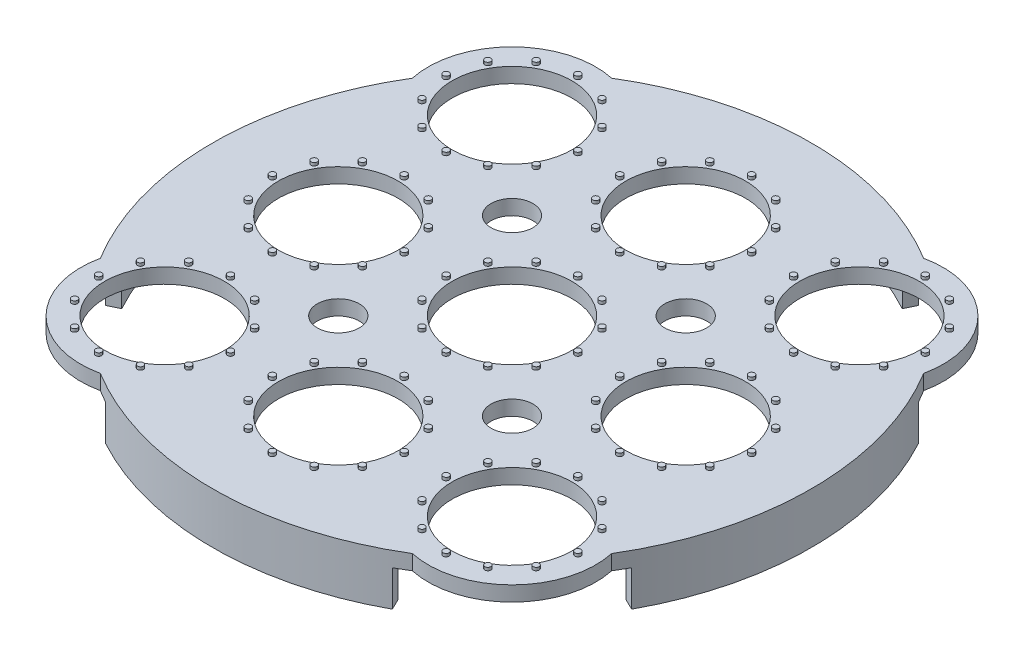
from build123d import *

# Parameters (mm, degrees)
BOSS_EXTRUDE1_DEPTH        = 2.5
SKETCH2_R                  = 10
CUT_EXTRUDE1_DEPTH         = 71.75485849
LPATTERN1_COUNT            = 3
LPATTERN1_PITCH            = 29
LPATTERN1_COUNT_DIR2       = 3
LPATTERN1_PITCH_DIR2       = 29
SKETCH4_R                  = 0.5
BOSS_EXTRUDE2_DEPTH        = 0.5
CIRPATTERN1_COUNT          = 12
LPATTERN2_COUNT            = 3
LPATTERN2_PITCH            = 29
LPATTERN2_COUNT_DIR2       = 3
LPATTERN2_PITCH_DIR2       = 29
LPATTERN2_COPY_1_SKETCH_R  = 0.5
LPATTERN2_COPY_1_DEPTH     = 0.5
LPATTERN2_COPY_2_SKETCH_R  = 0.5
LPATTERN2_COPY_2_DEPTH     = 0.5
LPATTERN2_COPY_3_SKETCH_R  = 0.5
LPATTERN2_COPY_3_DEPTH     = 0.5
LPATTERN2_COPY_4_SKETCH_R  = 0.5
LPATTERN2_COPY_4_DEPTH     = 0.5
LPATTERN2_COPY_5_SKETCH_R  = 0.5
LPATTERN2_COPY_5_DEPTH     = 0.5
LPATTERN2_COPY_6_SKETCH_R  = 0.5
LPATTERN2_COPY_6_DEPTH     = 0.5
LPATTERN2_COPY_7_SKETCH_R  = 0.5
LPATTERN2_COPY_7_DEPTH     = 0.5
LPATTERN2_COPY_8_SKETCH_R  = 0.5
LPATTERN2_COPY_8_DEPTH     = 0.5
LPATTERN2_COPY_9_SKETCH_R  = 0.5
LPATTERN2_COPY_9_DEPTH     = 0.5
LPATTERN2_COPY_10_SKETCH_R = 0.5
LPATTERN2_COPY_10_DEPTH    = 0.5
LPATTERN2_COPY_11_SKETCH_R = 0.5
LPATTERN2_COPY_11_DEPTH    = 0.5
LPATTERN2_COPY_12_SKETCH_R = 0.5
LPATTERN2_COPY_12_DEPTH    = 0.5
LPATTERN2_COPY_13_SKETCH_R = 0.5
LPATTERN2_COPY_13_DEPTH    = 0.5
LPATTERN2_COPY_14_SKETCH_R = 0.5
LPATTERN2_COPY_14_DEPTH    = 0.5
LPATTERN2_COPY_15_SKETCH_R = 0.5
LPATTERN2_COPY_15_DEPTH    = 0.5
LPATTERN2_COPY_16_SKETCH_R = 0.5
LPATTERN2_COPY_16_DEPTH    = 0.5
LPATTERN2_COPY_17_SKETCH_R = 0.5
LPATTERN2_COPY_17_DEPTH    = 0.5
LPATTERN2_COPY_18_SKETCH_R = 0.5
LPATTERN2_COPY_18_DEPTH    = 0.5
LPATTERN2_COPY_19_SKETCH_R = 0.5
LPATTERN2_COPY_19_DEPTH    = 0.5
LPATTERN2_COPY_20_SKETCH_R = 0.5
LPATTERN2_COPY_20_DEPTH    = 0.5
LPATTERN2_COPY_21_SKETCH_R = 0.5
LPATTERN2_COPY_21_DEPTH    = 0.5
LPATTERN2_COPY_22_SKETCH_R = 0.5
LPATTERN2_COPY_22_DEPTH    = 0.5
LPATTERN2_COPY_23_SKETCH_R = 0.5
LPATTERN2_COPY_23_DEPTH    = 0.5
LPATTERN2_COPY_24_SKETCH_R = 0.5
LPATTERN2_COPY_24_DEPTH    = 0.5
LPATTERN2_COPY_25_SKETCH_R = 0.5
LPATTERN2_COPY_25_DEPTH    = 0.5
LPATTERN2_COPY_26_SKETCH_R = 0.5
LPATTERN2_COPY_26_DEPTH    = 0.5
LPATTERN2_COPY_27_SKETCH_R = 0.5
LPATTERN2_COPY_27_DEPTH    = 0.5
LPATTERN2_COPY_28_SKETCH_R = 0.5
LPATTERN2_COPY_28_DEPTH    = 0.5
LPATTERN2_COPY_29_SKETCH_R = 0.5
LPATTERN2_COPY_29_DEPTH    = 0.5
LPATTERN2_COPY_30_SKETCH_R = 0.5
LPATTERN2_COPY_30_DEPTH    = 0.5
LPATTERN2_COPY_31_SKETCH_R = 0.5
LPATTERN2_COPY_31_DEPTH    = 0.5
LPATTERN2_COPY_32_SKETCH_R = 0.5
LPATTERN2_COPY_32_DEPTH    = 0.5
LPATTERN2_COPY_33_SKETCH_R = 0.5
LPATTERN2_COPY_33_DEPTH    = 0.5
LPATTERN2_COPY_34_SKETCH_R = 0.5
LPATTERN2_COPY_34_DEPTH    = 0.5
LPATTERN2_COPY_35_SKETCH_R = 0.5
LPATTERN2_COPY_35_DEPTH    = 0.5
LPATTERN2_COPY_36_SKETCH_R = 0.5
LPATTERN2_COPY_36_DEPTH    = 0.5
LPATTERN2_COPY_37_SKETCH_R = 0.5
LPATTERN2_COPY_37_DEPTH    = 0.5
LPATTERN2_COPY_38_SKETCH_R = 0.5
LPATTERN2_COPY_38_DEPTH    = 0.5
LPATTERN2_COPY_39_SKETCH_R = 0.5
LPATTERN2_COPY_39_DEPTH    = 0.5
LPATTERN2_COPY_40_SKETCH_R = 0.5
LPATTERN2_COPY_40_DEPTH    = 0.5
LPATTERN2_COPY_41_SKETCH_R = 0.5
LPATTERN2_COPY_41_DEPTH    = 0.5
LPATTERN2_COPY_42_SKETCH_R = 0.5
LPATTERN2_COPY_42_DEPTH    = 0.5
LPATTERN2_COPY_43_SKETCH_R = 0.5
LPATTERN2_COPY_43_DEPTH    = 0.5
LPATTERN2_COPY_44_SKETCH_R = 0.5
LPATTERN2_COPY_44_DEPTH    = 0.5
LPATTERN2_COPY_45_SKETCH_R = 0.5
LPATTERN2_COPY_45_DEPTH    = 0.5
LPATTERN2_COPY_46_SKETCH_R = 0.5
LPATTERN2_COPY_46_DEPTH    = 0.5
LPATTERN2_COPY_47_SKETCH_R = 0.5
LPATTERN2_COPY_47_DEPTH    = 0.5
LPATTERN2_COPY_48_SKETCH_R = 0.5
LPATTERN2_COPY_48_DEPTH    = 0.5
LPATTERN2_COPY_49_SKETCH_R = 0.5
LPATTERN2_COPY_49_DEPTH    = 0.5
LPATTERN2_COPY_50_SKETCH_R = 0.5
LPATTERN2_COPY_50_DEPTH    = 0.5
LPATTERN2_COPY_51_SKETCH_R = 0.5
LPATTERN2_COPY_51_DEPTH    = 0.5
LPATTERN2_COPY_52_SKETCH_R = 0.5
LPATTERN2_COPY_52_DEPTH    = 0.5
LPATTERN2_COPY_53_SKETCH_R = 0.5
LPATTERN2_COPY_53_DEPTH    = 0.5
LPATTERN2_COPY_54_SKETCH_R = 0.5
LPATTERN2_COPY_54_DEPTH    = 0.5
LPATTERN2_COPY_55_SKETCH_R = 0.5
LPATTERN2_COPY_55_DEPTH    = 0.5
LPATTERN2_COPY_56_SKETCH_R = 0.5
LPATTERN2_COPY_56_DEPTH    = 0.5
LPATTERN2_COPY_57_SKETCH_R = 0.5
LPATTERN2_COPY_57_DEPTH    = 0.5
LPATTERN2_COPY_58_SKETCH_R = 0.5
LPATTERN2_COPY_58_DEPTH    = 0.5
LPATTERN2_COPY_59_SKETCH_R = 0.5
LPATTERN2_COPY_59_DEPTH    = 0.5
LPATTERN2_COPY_60_SKETCH_R = 0.5
LPATTERN2_COPY_60_DEPTH    = 0.5
LPATTERN2_COPY_61_SKETCH_R = 0.5
LPATTERN2_COPY_61_DEPTH    = 0.5
LPATTERN2_COPY_62_SKETCH_R = 0.5
LPATTERN2_COPY_62_DEPTH    = 0.5
LPATTERN2_COPY_63_SKETCH_R = 0.5
LPATTERN2_COPY_63_DEPTH    = 0.5
LPATTERN2_COPY_64_SKETCH_R = 0.5
LPATTERN2_COPY_64_DEPTH    = 0.5
LPATTERN2_COPY_65_SKETCH_R = 0.5
LPATTERN2_COPY_65_DEPTH    = 0.5
LPATTERN2_COPY_66_SKETCH_R = 0.5
LPATTERN2_COPY_66_DEPTH    = 0.5
LPATTERN2_COPY_67_SKETCH_R = 0.5
LPATTERN2_COPY_67_DEPTH    = 0.5
LPATTERN2_COPY_68_SKETCH_R = 0.5
LPATTERN2_COPY_68_DEPTH    = 0.5
LPATTERN2_COPY_69_SKETCH_R = 0.5
LPATTERN2_COPY_69_DEPTH    = 0.5
LPATTERN2_COPY_70_SKETCH_R = 0.5
LPATTERN2_COPY_70_DEPTH    = 0.5
LPATTERN2_COPY_71_SKETCH_R = 0.5
LPATTERN2_COPY_71_DEPTH    = 0.5
LPATTERN2_COPY_72_SKETCH_R = 0.5
LPATTERN2_COPY_72_DEPTH    = 0.5
LPATTERN2_COPY_73_SKETCH_R = 0.5
LPATTERN2_COPY_73_DEPTH    = 0.5
LPATTERN2_COPY_74_SKETCH_R = 0.5
LPATTERN2_COPY_74_DEPTH    = 0.5
LPATTERN2_COPY_75_SKETCH_R = 0.5
LPATTERN2_COPY_75_DEPTH    = 0.5
LPATTERN2_COPY_76_SKETCH_R = 0.5
LPATTERN2_COPY_76_DEPTH    = 0.5
LPATTERN2_COPY_77_SKETCH_R = 0.5
LPATTERN2_COPY_77_DEPTH    = 0.5
LPATTERN2_COPY_78_SKETCH_R = 0.5
LPATTERN2_COPY_78_DEPTH    = 0.5
LPATTERN2_COPY_79_SKETCH_R = 0.5
LPATTERN2_COPY_79_DEPTH    = 0.5
LPATTERN2_COPY_80_SKETCH_R = 0.5
LPATTERN2_COPY_80_DEPTH    = 0.5
LPATTERN2_COPY_81_SKETCH_R = 0.5
LPATTERN2_COPY_81_DEPTH    = 0.5
LPATTERN2_COPY_82_SKETCH_R = 0.5
LPATTERN2_COPY_82_DEPTH    = 0.5
LPATTERN2_COPY_83_SKETCH_R = 0.5
LPATTERN2_COPY_83_DEPTH    = 0.5
LPATTERN2_COPY_84_SKETCH_R = 0.5
LPATTERN2_COPY_84_DEPTH    = 0.5
LPATTERN2_COPY_85_SKETCH_R = 0.5
LPATTERN2_COPY_85_DEPTH    = 0.5
LPATTERN2_COPY_86_SKETCH_R = 0.5
LPATTERN2_COPY_86_DEPTH    = 0.5
LPATTERN2_COPY_87_SKETCH_R = 0.5
LPATTERN2_COPY_87_DEPTH    = 0.5
LPATTERN2_COPY_88_SKETCH_R = 0.5
LPATTERN2_COPY_88_DEPTH    = 0.5
SKETCH5_R                  = 3.5
CUT_EXTRUDE2_DEPTH         = 71.75485849
MIRROR2_COPY_1_SKETCH_R    = 3.5
MIRROR2_COPY_1_DEPTH       = 71.75485849
BOSS_EXTRUDE3_START        = 6
BOSS_EXTRUDE3_DEPTH        = 6
CIRPATTERN2_COUNT          = 4


with BuildPart() as part:
    # Sketch1 → Boss-Extrude1 (new body)
    with BuildSketch(Plane(origin=(0, 0, 0), x_dir=(1, 0, 0), z_dir=(0, 1, 0))):
        with BuildLine():
            ThreePointArc((26.040517643, 42.683620288), (0, 50), (-26.040517643, 42.683620288))
            ThreePointArc((-26.040517643, 42.683620288), (-38.899494937, 38.899494937), (-42.683620288, 26.040517643))
            ThreePointArc((-42.683620288, 26.040517643), (-50, 0), (-42.683620288, -26.040517643))
            ThreePointArc((-42.683620288, -26.040517643), (-38.899494937, -38.899494937), (-26.040517643, -42.683620288))
            ThreePointArc((-26.040517643, -42.683620288), (0, -50), (26.040517643, -42.683620288))
            ThreePointArc((26.040517643, -42.683620288), (38.899494937, -38.899494937), (42.683620288, -26.040517643))
            ThreePointArc((42.683620288, -26.040517643), (50, 0), (42.683620288, 26.040517643))
            ThreePointArc((42.683620288, 26.040517643), (38.899494937, 38.899494937), (26.040517643, 42.683620288))
        make_face()
    extrude(amount=BOSS_EXTRUDE1_DEPTH)

    # Sketch2 → Cut-Extrude1 (cut, through all)
    with BuildSketch(Plane(origin=(0, 2.5, 0), x_dir=(1, 0, 0), z_dir=(0, 1, 0))):
        with Locations(Location((-29, -29, 0), (0, 0, 270))):
            Circle(SKETCH2_R)
    cut_extrude1 = extrude(amount=-CUT_EXTRUDE1_DEPTH, mode=Mode.SUBTRACT)

    # LPattern1: Cut-Extrude1 3 × 3
    with Locations(*[(i * LPATTERN1_PITCH, 0, -j * LPATTERN1_PITCH_DIR2) for i in range(LPATTERN1_COUNT) for j in range(LPATTERN1_COUNT_DIR2) if (i, j) != (0, 0)]):
        add(cut_extrude1, mode=Mode.SUBTRACT)

    # Sketch4 → Boss-Extrude2 (add)
    with BuildSketch(Plane(origin=(0, 2.5, 0), x_dir=(1, 0, 0), z_dir=(0, 1, 0))):
        with Locations(Location((-29, -18, 0), (0, 0, 270))):
            Circle(SKETCH4_R)
    boss_extrude2 = extrude(amount=BOSS_EXTRUDE2_DEPTH)

    # CirPattern1: Boss-Extrude2 ×12 about axis
    cirpattern1_axis = Axis((-29, 0, 29), (0, 1, 0))
    for i in range(1, CIRPATTERN1_COUNT):
        add(boss_extrude2.rotate(cirpattern1_axis, i * 360 / CIRPATTERN1_COUNT))

    # LPattern2: Boss-Extrude2 3 × 3
    with Locations(*[(j * LPATTERN2_PITCH_DIR2, 0, -i * LPATTERN2_PITCH) for i in range(LPATTERN2_COUNT) for j in range(LPATTERN2_COUNT_DIR2) if (i, j) != (0, 0)]):
        add(boss_extrude2)

    # LPattern2 copy 1 sketch → LPattern2 copy 1 (add)
    with BuildSketch(Plane(origin=(10.61473671, 2.5, -10.61473671), x_dir=(0.8660254037844387, 0, -0.49999999999999994), z_dir=(0, 1, 0))):
        with Locations(Location((-29, -18, 0), (0, 0, 270))):
            Circle(LPATTERN2_COPY_1_SKETCH_R)
    extrude(amount=LPATTERN2_COPY_1_DEPTH)

    # LPattern2 copy 2 sketch → LPattern2 copy 2 (add)
    with BuildSketch(Plane(origin=(39.61473671, 2.5, -10.61473671), x_dir=(0.8660254037844387, 0, -0.49999999999999994), z_dir=(0, 1, 0))):
        with Locations(Location((-29, -18, 0), (0, 0, 270))):
            Circle(LPATTERN2_COPY_2_SKETCH_R)
    extrude(amount=LPATTERN2_COPY_2_DEPTH)

    # LPattern2 copy 3 sketch → LPattern2 copy 3 (add)
    with BuildSketch(Plane(origin=(-18.38526329, 2.5, -39.61473671), x_dir=(0.8660254037844387, 0, -0.49999999999999994), z_dir=(0, 1, 0))):
        with Locations(Location((-29, -18, 0), (0, 0, 270))):
            Circle(LPATTERN2_COPY_3_SKETCH_R)
    extrude(amount=LPATTERN2_COPY_3_DEPTH)

    # LPattern2 copy 4 sketch → LPattern2 copy 4 (add)
    with BuildSketch(Plane(origin=(10.61473671, 2.5, -39.61473671), x_dir=(0.8660254037844387, 0, -0.49999999999999994), z_dir=(0, 1, 0))):
        with Locations(Location((-29, -18, 0), (0, 0, 270))):
            Circle(LPATTERN2_COPY_4_SKETCH_R)
    extrude(amount=LPATTERN2_COPY_4_DEPTH)

    # LPattern2 copy 5 sketch → LPattern2 copy 5 (add)
    with BuildSketch(Plane(origin=(39.61473671, 2.5, -39.61473671), x_dir=(0.8660254037844387, 0, -0.49999999999999994), z_dir=(0, 1, 0))):
        with Locations(Location((-29, -18, 0), (0, 0, 270))):
            Circle(LPATTERN2_COPY_5_SKETCH_R)
    extrude(amount=LPATTERN2_COPY_5_DEPTH)

    # LPattern2 copy 6 sketch → LPattern2 copy 6 (add)
    with BuildSketch(Plane(origin=(-18.38526329, 2.5, -68.61473671), x_dir=(0.8660254037844387, 0, -0.49999999999999994), z_dir=(0, 1, 0))):
        with Locations(Location((-29, -18, 0), (0, 0, 270))):
            Circle(LPATTERN2_COPY_6_SKETCH_R)
    extrude(amount=LPATTERN2_COPY_6_DEPTH)

    # LPattern2 copy 7 sketch → LPattern2 copy 7 (add)
    with BuildSketch(Plane(origin=(10.61473671, 2.5, -68.61473671), x_dir=(0.8660254037844387, 0, -0.49999999999999994), z_dir=(0, 1, 0))):
        with Locations(Location((-29, -18, 0), (0, 0, 270))):
            Circle(LPATTERN2_COPY_7_SKETCH_R)
    extrude(amount=LPATTERN2_COPY_7_DEPTH)

    # LPattern2 copy 8 sketch → LPattern2 copy 8 (add)
    with BuildSketch(Plane(origin=(39.61473671, 2.5, -68.61473671), x_dir=(0.8660254037844387, 0, -0.49999999999999994), z_dir=(0, 1, 0))):
        with Locations(Location((-29, -18, 0), (0, 0, 270))):
            Circle(LPATTERN2_COPY_8_SKETCH_R)
    extrude(amount=LPATTERN2_COPY_8_DEPTH)

    # LPattern2 copy 9 sketch → LPattern2 copy 9 (add)
    with BuildSketch(Plane(origin=(-10.61473671, 2.5, -10.61473671), x_dir=(0.5000000000000001, 0, -0.8660254037844386), z_dir=(0, 1, 0))):
        with Locations(Location((-29, -18, 0), (0, 0, 270))):
            Circle(LPATTERN2_COPY_9_SKETCH_R)
    extrude(amount=LPATTERN2_COPY_9_DEPTH)

    # LPattern2 copy 10 sketch → LPattern2 copy 10 (add)
    with BuildSketch(Plane(origin=(18.38526329, 2.5, -10.61473671), x_dir=(0.5000000000000001, 0, -0.8660254037844386), z_dir=(0, 1, 0))):
        with Locations(Location((-29, -18, 0), (0, 0, 270))):
            Circle(LPATTERN2_COPY_10_SKETCH_R)
    extrude(amount=LPATTERN2_COPY_10_DEPTH)

    # LPattern2 copy 11 sketch → LPattern2 copy 11 (add)
    with BuildSketch(Plane(origin=(-39.61473671, 2.5, -39.61473671), x_dir=(0.5000000000000001, 0, -0.8660254037844386), z_dir=(0, 1, 0))):
        with Locations(Location((-29, -18, 0), (0, 0, 270))):
            Circle(LPATTERN2_COPY_11_SKETCH_R)
    extrude(amount=LPATTERN2_COPY_11_DEPTH)

    # LPattern2 copy 12 sketch → LPattern2 copy 12 (add)
    with BuildSketch(Plane(origin=(-10.61473671, 2.5, -39.61473671), x_dir=(0.5000000000000001, 0, -0.8660254037844386), z_dir=(0, 1, 0))):
        with Locations(Location((-29, -18, 0), (0, 0, 270))):
            Circle(LPATTERN2_COPY_12_SKETCH_R)
    extrude(amount=LPATTERN2_COPY_12_DEPTH)

    # LPattern2 copy 13 sketch → LPattern2 copy 13 (add)
    with BuildSketch(Plane(origin=(18.38526329, 2.5, -39.61473671), x_dir=(0.5000000000000001, 0, -0.8660254037844386), z_dir=(0, 1, 0))):
        with Locations(Location((-29, -18, 0), (0, 0, 270))):
            Circle(LPATTERN2_COPY_13_SKETCH_R)
    extrude(amount=LPATTERN2_COPY_13_DEPTH)

    # LPattern2 copy 14 sketch → LPattern2 copy 14 (add)
    with BuildSketch(Plane(origin=(-39.61473671, 2.5, -68.61473671), x_dir=(0.5000000000000001, 0, -0.8660254037844386), z_dir=(0, 1, 0))):
        with Locations(Location((-29, -18, 0), (0, 0, 270))):
            Circle(LPATTERN2_COPY_14_SKETCH_R)
    extrude(amount=LPATTERN2_COPY_14_DEPTH)

    # LPattern2 copy 15 sketch → LPattern2 copy 15 (add)
    with BuildSketch(Plane(origin=(-10.61473671, 2.5, -68.61473671), x_dir=(0.5000000000000001, 0, -0.8660254037844386), z_dir=(0, 1, 0))):
        with Locations(Location((-29, -18, 0), (0, 0, 270))):
            Circle(LPATTERN2_COPY_15_SKETCH_R)
    extrude(amount=LPATTERN2_COPY_15_DEPTH)

    # LPattern2 copy 16 sketch → LPattern2 copy 16 (add)
    with BuildSketch(Plane(origin=(18.38526329, 2.5, -68.61473671), x_dir=(0.5000000000000001, 0, -0.8660254037844386), z_dir=(0, 1, 0))):
        with Locations(Location((-29, -18, 0), (0, 0, 270))):
            Circle(LPATTERN2_COPY_16_SKETCH_R)
    extrude(amount=LPATTERN2_COPY_16_DEPTH)

    # LPattern2 copy 17 sketch → LPattern2 copy 17 (add)
    with BuildSketch(Plane(origin=(-29, 2.5, 0), x_dir=(0, 0, -1), z_dir=(0, 1, 0))):
        with Locations(Location((-29, -18, 0), (0, 0, 270))):
            Circle(LPATTERN2_COPY_17_SKETCH_R)
    extrude(amount=LPATTERN2_COPY_17_DEPTH)

    # LPattern2 copy 18 sketch → LPattern2 copy 18 (add)
    with BuildSketch(Plane(origin=(0, 2.5, 0), x_dir=(0, 0, -1), z_dir=(0, 1, 0))):
        with Locations(Location((-29, -18, 0), (0, 0, 270))):
            Circle(LPATTERN2_COPY_18_SKETCH_R)
    extrude(amount=LPATTERN2_COPY_18_DEPTH)

    # LPattern2 copy 19 sketch → LPattern2 copy 19 (add)
    with BuildSketch(Plane(origin=(-58, 2.5, -29), x_dir=(0, 0, -1), z_dir=(0, 1, 0))):
        with Locations(Location((-29, -18, 0), (0, 0, 270))):
            Circle(LPATTERN2_COPY_19_SKETCH_R)
    extrude(amount=LPATTERN2_COPY_19_DEPTH)

    # LPattern2 copy 20 sketch → LPattern2 copy 20 (add)
    with BuildSketch(Plane(origin=(-29, 2.5, -29), x_dir=(0, 0, -1), z_dir=(0, 1, 0))):
        with Locations(Location((-29, -18, 0), (0, 0, 270))):
            Circle(LPATTERN2_COPY_20_SKETCH_R)
    extrude(amount=LPATTERN2_COPY_20_DEPTH)

    # LPattern2 copy 21 sketch → LPattern2 copy 21 (add)
    with BuildSketch(Plane(origin=(0, 2.5, -29), x_dir=(0, 0, -1), z_dir=(0, 1, 0))):
        with Locations(Location((-29, -18, 0), (0, 0, 270))):
            Circle(LPATTERN2_COPY_21_SKETCH_R)
    extrude(amount=LPATTERN2_COPY_21_DEPTH)

    # LPattern2 copy 22 sketch → LPattern2 copy 22 (add)
    with BuildSketch(Plane(origin=(-58, 2.5, -58), x_dir=(0, 0, -1), z_dir=(0, 1, 0))):
        with Locations(Location((-29, -18, 0), (0, 0, 270))):
            Circle(LPATTERN2_COPY_22_SKETCH_R)
    extrude(amount=LPATTERN2_COPY_22_DEPTH)

    # LPattern2 copy 23 sketch → LPattern2 copy 23 (add)
    with BuildSketch(Plane(origin=(-29, 2.5, -58), x_dir=(0, 0, -1), z_dir=(0, 1, 0))):
        with Locations(Location((-29, -18, 0), (0, 0, 270))):
            Circle(LPATTERN2_COPY_23_SKETCH_R)
    extrude(amount=LPATTERN2_COPY_23_DEPTH)

    # LPattern2 copy 24 sketch → LPattern2 copy 24 (add)
    with BuildSketch(Plane(origin=(0, 2.5, -58), x_dir=(0, 0, -1), z_dir=(0, 1, 0))):
        with Locations(Location((-29, -18, 0), (0, 0, 270))):
            Circle(LPATTERN2_COPY_24_SKETCH_R)
    extrude(amount=LPATTERN2_COPY_24_DEPTH)

    # LPattern2 copy 25 sketch → LPattern2 copy 25 (add)
    with BuildSketch(Plane(origin=(-39.61473671, 2.5, 18.38526329), x_dir=(-0.4999999999999998, 0, -0.8660254037844387), z_dir=(0, 1, 0))):
        with Locations(Location((-29, -18, 0), (0, 0, 270))):
            Circle(LPATTERN2_COPY_25_SKETCH_R)
    extrude(amount=LPATTERN2_COPY_25_DEPTH)

    # LPattern2 copy 26 sketch → LPattern2 copy 26 (add)
    with BuildSketch(Plane(origin=(-10.61473671, 2.5, 18.38526329), x_dir=(-0.4999999999999998, 0, -0.8660254037844387), z_dir=(0, 1, 0))):
        with Locations(Location((-29, -18, 0), (0, 0, 270))):
            Circle(LPATTERN2_COPY_26_SKETCH_R)
    extrude(amount=LPATTERN2_COPY_26_DEPTH)

    # LPattern2 copy 27 sketch → LPattern2 copy 27 (add)
    with BuildSketch(Plane(origin=(-68.61473671, 2.5, -10.61473671), x_dir=(-0.4999999999999998, 0, -0.8660254037844387), z_dir=(0, 1, 0))):
        with Locations(Location((-29, -18, 0), (0, 0, 270))):
            Circle(LPATTERN2_COPY_27_SKETCH_R)
    extrude(amount=LPATTERN2_COPY_27_DEPTH)

    # LPattern2 copy 28 sketch → LPattern2 copy 28 (add)
    with BuildSketch(Plane(origin=(-39.61473671, 2.5, -10.61473671), x_dir=(-0.4999999999999998, 0, -0.8660254037844387), z_dir=(0, 1, 0))):
        with Locations(Location((-29, -18, 0), (0, 0, 270))):
            Circle(LPATTERN2_COPY_28_SKETCH_R)
    extrude(amount=LPATTERN2_COPY_28_DEPTH)

    # LPattern2 copy 29 sketch → LPattern2 copy 29 (add)
    with BuildSketch(Plane(origin=(-10.61473671, 2.5, -10.61473671), x_dir=(-0.4999999999999998, 0, -0.8660254037844387), z_dir=(0, 1, 0))):
        with Locations(Location((-29, -18, 0), (0, 0, 270))):
            Circle(LPATTERN2_COPY_29_SKETCH_R)
    extrude(amount=LPATTERN2_COPY_29_DEPTH)

    # LPattern2 copy 30 sketch → LPattern2 copy 30 (add)
    with BuildSketch(Plane(origin=(-68.61473671, 2.5, -39.61473671), x_dir=(-0.4999999999999998, 0, -0.8660254037844387), z_dir=(0, 1, 0))):
        with Locations(Location((-29, -18, 0), (0, 0, 270))):
            Circle(LPATTERN2_COPY_30_SKETCH_R)
    extrude(amount=LPATTERN2_COPY_30_DEPTH)

    # LPattern2 copy 31 sketch → LPattern2 copy 31 (add)
    with BuildSketch(Plane(origin=(-39.61473671, 2.5, -39.61473671), x_dir=(-0.4999999999999998, 0, -0.8660254037844387), z_dir=(0, 1, 0))):
        with Locations(Location((-29, -18, 0), (0, 0, 270))):
            Circle(LPATTERN2_COPY_31_SKETCH_R)
    extrude(amount=LPATTERN2_COPY_31_DEPTH)

    # LPattern2 copy 32 sketch → LPattern2 copy 32 (add)
    with BuildSketch(Plane(origin=(-10.61473671, 2.5, -39.61473671), x_dir=(-0.4999999999999998, 0, -0.8660254037844387), z_dir=(0, 1, 0))):
        with Locations(Location((-29, -18, 0), (0, 0, 270))):
            Circle(LPATTERN2_COPY_32_SKETCH_R)
    extrude(amount=LPATTERN2_COPY_32_DEPTH)

    # LPattern2 copy 33 sketch → LPattern2 copy 33 (add)
    with BuildSketch(Plane(origin=(-39.61473671, 2.5, 39.61473671), x_dir=(-0.8660254037844387, 0, -0.49999999999999994), z_dir=(0, 1, 0))):
        with Locations(Location((-29, -18, 0), (0, 0, 270))):
            Circle(LPATTERN2_COPY_33_SKETCH_R)
    extrude(amount=LPATTERN2_COPY_33_DEPTH)

    # LPattern2 copy 34 sketch → LPattern2 copy 34 (add)
    with BuildSketch(Plane(origin=(-10.61473671, 2.5, 39.61473671), x_dir=(-0.8660254037844387, 0, -0.49999999999999994), z_dir=(0, 1, 0))):
        with Locations(Location((-29, -18, 0), (0, 0, 270))):
            Circle(LPATTERN2_COPY_34_SKETCH_R)
    extrude(amount=LPATTERN2_COPY_34_DEPTH)

    # LPattern2 copy 35 sketch → LPattern2 copy 35 (add)
    with BuildSketch(Plane(origin=(-68.61473671, 2.5, 10.61473671), x_dir=(-0.8660254037844387, 0, -0.49999999999999994), z_dir=(0, 1, 0))):
        with Locations(Location((-29, -18, 0), (0, 0, 270))):
            Circle(LPATTERN2_COPY_35_SKETCH_R)
    extrude(amount=LPATTERN2_COPY_35_DEPTH)

    # LPattern2 copy 36 sketch → LPattern2 copy 36 (add)
    with BuildSketch(Plane(origin=(-39.61473671, 2.5, 10.61473671), x_dir=(-0.8660254037844387, 0, -0.49999999999999994), z_dir=(0, 1, 0))):
        with Locations(Location((-29, -18, 0), (0, 0, 270))):
            Circle(LPATTERN2_COPY_36_SKETCH_R)
    extrude(amount=LPATTERN2_COPY_36_DEPTH)

    # LPattern2 copy 37 sketch → LPattern2 copy 37 (add)
    with BuildSketch(Plane(origin=(-10.61473671, 2.5, 10.61473671), x_dir=(-0.8660254037844387, 0, -0.49999999999999994), z_dir=(0, 1, 0))):
        with Locations(Location((-29, -18, 0), (0, 0, 270))):
            Circle(LPATTERN2_COPY_37_SKETCH_R)
    extrude(amount=LPATTERN2_COPY_37_DEPTH)

    # LPattern2 copy 38 sketch → LPattern2 copy 38 (add)
    with BuildSketch(Plane(origin=(-68.61473671, 2.5, -18.38526329), x_dir=(-0.8660254037844387, 0, -0.49999999999999994), z_dir=(0, 1, 0))):
        with Locations(Location((-29, -18, 0), (0, 0, 270))):
            Circle(LPATTERN2_COPY_38_SKETCH_R)
    extrude(amount=LPATTERN2_COPY_38_DEPTH)

    # LPattern2 copy 39 sketch → LPattern2 copy 39 (add)
    with BuildSketch(Plane(origin=(-39.61473671, 2.5, -18.38526329), x_dir=(-0.8660254037844387, 0, -0.49999999999999994), z_dir=(0, 1, 0))):
        with Locations(Location((-29, -18, 0), (0, 0, 270))):
            Circle(LPATTERN2_COPY_39_SKETCH_R)
    extrude(amount=LPATTERN2_COPY_39_DEPTH)

    # LPattern2 copy 40 sketch → LPattern2 copy 40 (add)
    with BuildSketch(Plane(origin=(-10.61473671, 2.5, -18.38526329), x_dir=(-0.8660254037844387, 0, -0.49999999999999994), z_dir=(0, 1, 0))):
        with Locations(Location((-29, -18, 0), (0, 0, 270))):
            Circle(LPATTERN2_COPY_40_SKETCH_R)
    extrude(amount=LPATTERN2_COPY_40_DEPTH)

    # LPattern2 copy 41 sketch → LPattern2 copy 41 (add)
    with BuildSketch(Plane(origin=(-29, 2.5, 58), x_dir=(-1, 0, 0), z_dir=(0, 1, 0))):
        with Locations(Location((-29, -18, 0), (0, 0, 270))):
            Circle(LPATTERN2_COPY_41_SKETCH_R)
    extrude(amount=LPATTERN2_COPY_41_DEPTH)

    # LPattern2 copy 42 sketch → LPattern2 copy 42 (add)
    with BuildSketch(Plane(origin=(0, 2.5, 58), x_dir=(-1, 0, 0), z_dir=(0, 1, 0))):
        with Locations(Location((-29, -18, 0), (0, 0, 270))):
            Circle(LPATTERN2_COPY_42_SKETCH_R)
    extrude(amount=LPATTERN2_COPY_42_DEPTH)

    # LPattern2 copy 43 sketch → LPattern2 copy 43 (add)
    with BuildSketch(Plane(origin=(-58, 2.5, 29), x_dir=(-1, 0, 0), z_dir=(0, 1, 0))):
        with Locations(Location((-29, -18, 0), (0, 0, 270))):
            Circle(LPATTERN2_COPY_43_SKETCH_R)
    extrude(amount=LPATTERN2_COPY_43_DEPTH)

    # LPattern2 copy 44 sketch → LPattern2 copy 44 (add)
    with BuildSketch(Plane(origin=(-29, 2.5, 29), x_dir=(-1, 0, 0), z_dir=(0, 1, 0))):
        with Locations(Location((-29, -18, 0), (0, 0, 270))):
            Circle(LPATTERN2_COPY_44_SKETCH_R)
    extrude(amount=LPATTERN2_COPY_44_DEPTH)

    # LPattern2 copy 45 sketch → LPattern2 copy 45 (add)
    with BuildSketch(Plane(origin=(0, 2.5, 29), x_dir=(-1, 0, 0), z_dir=(0, 1, 0))):
        with Locations(Location((-29, -18, 0), (0, 0, 270))):
            Circle(LPATTERN2_COPY_45_SKETCH_R)
    extrude(amount=LPATTERN2_COPY_45_DEPTH)

    # LPattern2 copy 46 sketch → LPattern2 copy 46 (add)
    with BuildSketch(Plane(origin=(-58, 2.5, 0), x_dir=(-1, 0, 0), z_dir=(0, 1, 0))):
        with Locations(Location((-29, -18, 0), (0, 0, 270))):
            Circle(LPATTERN2_COPY_46_SKETCH_R)
    extrude(amount=LPATTERN2_COPY_46_DEPTH)

    # LPattern2 copy 47 sketch → LPattern2 copy 47 (add)
    with BuildSketch(Plane(origin=(-29, 2.5, 0), x_dir=(-1, 0, 0), z_dir=(0, 1, 0))):
        with Locations(Location((-29, -18, 0), (0, 0, 270))):
            Circle(LPATTERN2_COPY_47_SKETCH_R)
    extrude(amount=LPATTERN2_COPY_47_DEPTH)

    # LPattern2 copy 48 sketch → LPattern2 copy 48 (add)
    with BuildSketch(Plane(origin=(0, 2.5, 0), x_dir=(-1, 0, 0), z_dir=(0, 1, 0))):
        with Locations(Location((-29, -18, 0), (0, 0, 270))):
            Circle(LPATTERN2_COPY_48_SKETCH_R)
    extrude(amount=LPATTERN2_COPY_48_DEPTH)

    # LPattern2 copy 49 sketch → LPattern2 copy 49 (add)
    with BuildSketch(Plane(origin=(-10.61473671, 2.5, 68.61473671), x_dir=(-0.8660254037844386, 0, 0.5000000000000001), z_dir=(0, 1, 0))):
        with Locations(Location((-29, -18, 0), (0, 0, 270))):
            Circle(LPATTERN2_COPY_49_SKETCH_R)
    extrude(amount=LPATTERN2_COPY_49_DEPTH)

    # LPattern2 copy 50 sketch → LPattern2 copy 50 (add)
    with BuildSketch(Plane(origin=(18.38526329, 2.5, 68.61473671), x_dir=(-0.8660254037844386, 0, 0.5000000000000001), z_dir=(0, 1, 0))):
        with Locations(Location((-29, -18, 0), (0, 0, 270))):
            Circle(LPATTERN2_COPY_50_SKETCH_R)
    extrude(amount=LPATTERN2_COPY_50_DEPTH)

    # LPattern2 copy 51 sketch → LPattern2 copy 51 (add)
    with BuildSketch(Plane(origin=(-39.61473671, 2.5, 39.61473671), x_dir=(-0.8660254037844386, 0, 0.5000000000000001), z_dir=(0, 1, 0))):
        with Locations(Location((-29, -18, 0), (0, 0, 270))):
            Circle(LPATTERN2_COPY_51_SKETCH_R)
    extrude(amount=LPATTERN2_COPY_51_DEPTH)

    # LPattern2 copy 52 sketch → LPattern2 copy 52 (add)
    with BuildSketch(Plane(origin=(-10.61473671, 2.5, 39.61473671), x_dir=(-0.8660254037844386, 0, 0.5000000000000001), z_dir=(0, 1, 0))):
        with Locations(Location((-29, -18, 0), (0, 0, 270))):
            Circle(LPATTERN2_COPY_52_SKETCH_R)
    extrude(amount=LPATTERN2_COPY_52_DEPTH)

    # LPattern2 copy 53 sketch → LPattern2 copy 53 (add)
    with BuildSketch(Plane(origin=(18.38526329, 2.5, 39.61473671), x_dir=(-0.8660254037844386, 0, 0.5000000000000001), z_dir=(0, 1, 0))):
        with Locations(Location((-29, -18, 0), (0, 0, 270))):
            Circle(LPATTERN2_COPY_53_SKETCH_R)
    extrude(amount=LPATTERN2_COPY_53_DEPTH)

    # LPattern2 copy 54 sketch → LPattern2 copy 54 (add)
    with BuildSketch(Plane(origin=(-39.61473671, 2.5, 10.61473671), x_dir=(-0.8660254037844386, 0, 0.5000000000000001), z_dir=(0, 1, 0))):
        with Locations(Location((-29, -18, 0), (0, 0, 270))):
            Circle(LPATTERN2_COPY_54_SKETCH_R)
    extrude(amount=LPATTERN2_COPY_54_DEPTH)

    # LPattern2 copy 55 sketch → LPattern2 copy 55 (add)
    with BuildSketch(Plane(origin=(-10.61473671, 2.5, 10.61473671), x_dir=(-0.8660254037844386, 0, 0.5000000000000001), z_dir=(0, 1, 0))):
        with Locations(Location((-29, -18, 0), (0, 0, 270))):
            Circle(LPATTERN2_COPY_55_SKETCH_R)
    extrude(amount=LPATTERN2_COPY_55_DEPTH)

    # LPattern2 copy 56 sketch → LPattern2 copy 56 (add)
    with BuildSketch(Plane(origin=(18.38526329, 2.5, 10.61473671), x_dir=(-0.8660254037844386, 0, 0.5000000000000001), z_dir=(0, 1, 0))):
        with Locations(Location((-29, -18, 0), (0, 0, 270))):
            Circle(LPATTERN2_COPY_56_SKETCH_R)
    extrude(amount=LPATTERN2_COPY_56_DEPTH)

    # LPattern2 copy 57 sketch → LPattern2 copy 57 (add)
    with BuildSketch(Plane(origin=(10.61473671, 2.5, 68.61473671), x_dir=(-0.5000000000000004, 0, 0.8660254037844384), z_dir=(0, 1, 0))):
        with Locations(Location((-29, -18, 0), (0, 0, 270))):
            Circle(LPATTERN2_COPY_57_SKETCH_R)
    extrude(amount=LPATTERN2_COPY_57_DEPTH)

    # LPattern2 copy 58 sketch → LPattern2 copy 58 (add)
    with BuildSketch(Plane(origin=(39.61473671, 2.5, 68.61473671), x_dir=(-0.5000000000000004, 0, 0.8660254037844384), z_dir=(0, 1, 0))):
        with Locations(Location((-29, -18, 0), (0, 0, 270))):
            Circle(LPATTERN2_COPY_58_SKETCH_R)
    extrude(amount=LPATTERN2_COPY_58_DEPTH)

    # LPattern2 copy 59 sketch → LPattern2 copy 59 (add)
    with BuildSketch(Plane(origin=(-18.38526329, 2.5, 39.61473671), x_dir=(-0.5000000000000004, 0, 0.8660254037844384), z_dir=(0, 1, 0))):
        with Locations(Location((-29, -18, 0), (0, 0, 270))):
            Circle(LPATTERN2_COPY_59_SKETCH_R)
    extrude(amount=LPATTERN2_COPY_59_DEPTH)

    # LPattern2 copy 60 sketch → LPattern2 copy 60 (add)
    with BuildSketch(Plane(origin=(10.61473671, 2.5, 39.61473671), x_dir=(-0.5000000000000004, 0, 0.8660254037844384), z_dir=(0, 1, 0))):
        with Locations(Location((-29, -18, 0), (0, 0, 270))):
            Circle(LPATTERN2_COPY_60_SKETCH_R)
    extrude(amount=LPATTERN2_COPY_60_DEPTH)

    # LPattern2 copy 61 sketch → LPattern2 copy 61 (add)
    with BuildSketch(Plane(origin=(39.61473671, 2.5, 39.61473671), x_dir=(-0.5000000000000004, 0, 0.8660254037844384), z_dir=(0, 1, 0))):
        with Locations(Location((-29, -18, 0), (0, 0, 270))):
            Circle(LPATTERN2_COPY_61_SKETCH_R)
    extrude(amount=LPATTERN2_COPY_61_DEPTH)

    # LPattern2 copy 62 sketch → LPattern2 copy 62 (add)
    with BuildSketch(Plane(origin=(-18.38526329, 2.5, 10.61473671), x_dir=(-0.5000000000000004, 0, 0.8660254037844384), z_dir=(0, 1, 0))):
        with Locations(Location((-29, -18, 0), (0, 0, 270))):
            Circle(LPATTERN2_COPY_62_SKETCH_R)
    extrude(amount=LPATTERN2_COPY_62_DEPTH)

    # LPattern2 copy 63 sketch → LPattern2 copy 63 (add)
    with BuildSketch(Plane(origin=(10.61473671, 2.5, 10.61473671), x_dir=(-0.5000000000000004, 0, 0.8660254037844384), z_dir=(0, 1, 0))):
        with Locations(Location((-29, -18, 0), (0, 0, 270))):
            Circle(LPATTERN2_COPY_63_SKETCH_R)
    extrude(amount=LPATTERN2_COPY_63_DEPTH)

    # LPattern2 copy 64 sketch → LPattern2 copy 64 (add)
    with BuildSketch(Plane(origin=(39.61473671, 2.5, 10.61473671), x_dir=(-0.5000000000000004, 0, 0.8660254037844384), z_dir=(0, 1, 0))):
        with Locations(Location((-29, -18, 0), (0, 0, 270))):
            Circle(LPATTERN2_COPY_64_SKETCH_R)
    extrude(amount=LPATTERN2_COPY_64_DEPTH)

    # LPattern2 copy 65 sketch → LPattern2 copy 65 (add)
    with BuildSketch(Plane(origin=(29, 2.5, 58), x_dir=(0, 0, 1), z_dir=(0, 1, 0))):
        with Locations(Location((-29, -18, 0), (0, 0, 270))):
            Circle(LPATTERN2_COPY_65_SKETCH_R)
    extrude(amount=LPATTERN2_COPY_65_DEPTH)

    # LPattern2 copy 66 sketch → LPattern2 copy 66 (add)
    with BuildSketch(Plane(origin=(58, 2.5, 58), x_dir=(0, 0, 1), z_dir=(0, 1, 0))):
        with Locations(Location((-29, -18, 0), (0, 0, 270))):
            Circle(LPATTERN2_COPY_66_SKETCH_R)
    extrude(amount=LPATTERN2_COPY_66_DEPTH)

    # LPattern2 copy 67 sketch → LPattern2 copy 67 (add)
    with BuildSketch(Plane(origin=(0, 2.5, 29), x_dir=(0, 0, 1), z_dir=(0, 1, 0))):
        with Locations(Location((-29, -18, 0), (0, 0, 270))):
            Circle(LPATTERN2_COPY_67_SKETCH_R)
    extrude(amount=LPATTERN2_COPY_67_DEPTH)

    # LPattern2 copy 68 sketch → LPattern2 copy 68 (add)
    with BuildSketch(Plane(origin=(29, 2.5, 29), x_dir=(0, 0, 1), z_dir=(0, 1, 0))):
        with Locations(Location((-29, -18, 0), (0, 0, 270))):
            Circle(LPATTERN2_COPY_68_SKETCH_R)
    extrude(amount=LPATTERN2_COPY_68_DEPTH)

    # LPattern2 copy 69 sketch → LPattern2 copy 69 (add)
    with BuildSketch(Plane(origin=(58, 2.5, 29), x_dir=(0, 0, 1), z_dir=(0, 1, 0))):
        with Locations(Location((-29, -18, 0), (0, 0, 270))):
            Circle(LPATTERN2_COPY_69_SKETCH_R)
    extrude(amount=LPATTERN2_COPY_69_DEPTH)

    # LPattern2 copy 70 sketch → LPattern2 copy 70 (add)
    with BuildSketch(Plane.ZX.offset(2.5)):
        with Locations(Location((-29, -18, 0), (0, 0, 270))):
            Circle(LPATTERN2_COPY_70_SKETCH_R)
    extrude(amount=LPATTERN2_COPY_70_DEPTH)

    # LPattern2 copy 71 sketch → LPattern2 copy 71 (add)
    with BuildSketch(Plane(origin=(29, 2.5, 0), x_dir=(0, 0, 1), z_dir=(0, 1, 0))):
        with Locations(Location((-29, -18, 0), (0, 0, 270))):
            Circle(LPATTERN2_COPY_71_SKETCH_R)
    extrude(amount=LPATTERN2_COPY_71_DEPTH)

    # LPattern2 copy 72 sketch → LPattern2 copy 72 (add)
    with BuildSketch(Plane(origin=(58, 2.5, 0), x_dir=(0, 0, 1), z_dir=(0, 1, 0))):
        with Locations(Location((-29, -18, 0), (0, 0, 270))):
            Circle(LPATTERN2_COPY_72_SKETCH_R)
    extrude(amount=LPATTERN2_COPY_72_DEPTH)

    # LPattern2 copy 73 sketch → LPattern2 copy 73 (add)
    with BuildSketch(Plane(origin=(39.61473671, 2.5, 39.61473671), x_dir=(0.5000000000000001, 0, 0.8660254037844386), z_dir=(0, 1, 0))):
        with Locations(Location((-29, -18, 0), (0, 0, 270))):
            Circle(LPATTERN2_COPY_73_SKETCH_R)
    extrude(amount=LPATTERN2_COPY_73_DEPTH)

    # LPattern2 copy 74 sketch → LPattern2 copy 74 (add)
    with BuildSketch(Plane(origin=(68.61473671, 2.5, 39.61473671), x_dir=(0.5000000000000001, 0, 0.8660254037844386), z_dir=(0, 1, 0))):
        with Locations(Location((-29, -18, 0), (0, 0, 270))):
            Circle(LPATTERN2_COPY_74_SKETCH_R)
    extrude(amount=LPATTERN2_COPY_74_DEPTH)

    # LPattern2 copy 75 sketch → LPattern2 copy 75 (add)
    with BuildSketch(Plane(origin=(10.61473671, 2.5, 10.61473671), x_dir=(0.5000000000000001, 0, 0.8660254037844386), z_dir=(0, 1, 0))):
        with Locations(Location((-29, -18, 0), (0, 0, 270))):
            Circle(LPATTERN2_COPY_75_SKETCH_R)
    extrude(amount=LPATTERN2_COPY_75_DEPTH)

    # LPattern2 copy 76 sketch → LPattern2 copy 76 (add)
    with BuildSketch(Plane(origin=(39.61473671, 2.5, 10.61473671), x_dir=(0.5000000000000001, 0, 0.8660254037844386), z_dir=(0, 1, 0))):
        with Locations(Location((-29, -18, 0), (0, 0, 270))):
            Circle(LPATTERN2_COPY_76_SKETCH_R)
    extrude(amount=LPATTERN2_COPY_76_DEPTH)

    # LPattern2 copy 77 sketch → LPattern2 copy 77 (add)
    with BuildSketch(Plane(origin=(68.61473671, 2.5, 10.61473671), x_dir=(0.5000000000000001, 0, 0.8660254037844386), z_dir=(0, 1, 0))):
        with Locations(Location((-29, -18, 0), (0, 0, 270))):
            Circle(LPATTERN2_COPY_77_SKETCH_R)
    extrude(amount=LPATTERN2_COPY_77_DEPTH)

    # LPattern2 copy 78 sketch → LPattern2 copy 78 (add)
    with BuildSketch(Plane(origin=(10.61473671, 2.5, -18.38526329), x_dir=(0.5000000000000001, 0, 0.8660254037844386), z_dir=(0, 1, 0))):
        with Locations(Location((-29, -18, 0), (0, 0, 270))):
            Circle(LPATTERN2_COPY_78_SKETCH_R)
    extrude(amount=LPATTERN2_COPY_78_DEPTH)

    # LPattern2 copy 79 sketch → LPattern2 copy 79 (add)
    with BuildSketch(Plane(origin=(39.61473671, 2.5, -18.38526329), x_dir=(0.5000000000000001, 0, 0.8660254037844386), z_dir=(0, 1, 0))):
        with Locations(Location((-29, -18, 0), (0, 0, 270))):
            Circle(LPATTERN2_COPY_79_SKETCH_R)
    extrude(amount=LPATTERN2_COPY_79_DEPTH)

    # LPattern2 copy 80 sketch → LPattern2 copy 80 (add)
    with BuildSketch(Plane(origin=(68.61473671, 2.5, -18.38526329), x_dir=(0.5000000000000001, 0, 0.8660254037844386), z_dir=(0, 1, 0))):
        with Locations(Location((-29, -18, 0), (0, 0, 270))):
            Circle(LPATTERN2_COPY_80_SKETCH_R)
    extrude(amount=LPATTERN2_COPY_80_DEPTH)

    # LPattern2 copy 81 sketch → LPattern2 copy 81 (add)
    with BuildSketch(Plane(origin=(39.61473671, 2.5, 18.38526329), x_dir=(0.8660254037844384, 0, 0.5000000000000004), z_dir=(0, 1, 0))):
        with Locations(Location((-29, -18, 0), (0, 0, 270))):
            Circle(LPATTERN2_COPY_81_SKETCH_R)
    extrude(amount=LPATTERN2_COPY_81_DEPTH)

    # LPattern2 copy 82 sketch → LPattern2 copy 82 (add)
    with BuildSketch(Plane(origin=(68.61473671, 2.5, 18.38526329), x_dir=(0.8660254037844384, 0, 0.5000000000000004), z_dir=(0, 1, 0))):
        with Locations(Location((-29, -18, 0), (0, 0, 270))):
            Circle(LPATTERN2_COPY_82_SKETCH_R)
    extrude(amount=LPATTERN2_COPY_82_DEPTH)

    # LPattern2 copy 83 sketch → LPattern2 copy 83 (add)
    with BuildSketch(Plane(origin=(10.61473671, 2.5, -10.61473671), x_dir=(0.8660254037844384, 0, 0.5000000000000004), z_dir=(0, 1, 0))):
        with Locations(Location((-29, -18, 0), (0, 0, 270))):
            Circle(LPATTERN2_COPY_83_SKETCH_R)
    extrude(amount=LPATTERN2_COPY_83_DEPTH)

    # LPattern2 copy 84 sketch → LPattern2 copy 84 (add)
    with BuildSketch(Plane(origin=(39.61473671, 2.5, -10.61473671), x_dir=(0.8660254037844384, 0, 0.5000000000000004), z_dir=(0, 1, 0))):
        with Locations(Location((-29, -18, 0), (0, 0, 270))):
            Circle(LPATTERN2_COPY_84_SKETCH_R)
    extrude(amount=LPATTERN2_COPY_84_DEPTH)

    # LPattern2 copy 85 sketch → LPattern2 copy 85 (add)
    with BuildSketch(Plane(origin=(68.61473671, 2.5, -10.61473671), x_dir=(0.8660254037844384, 0, 0.5000000000000004), z_dir=(0, 1, 0))):
        with Locations(Location((-29, -18, 0), (0, 0, 270))):
            Circle(LPATTERN2_COPY_85_SKETCH_R)
    extrude(amount=LPATTERN2_COPY_85_DEPTH)

    # LPattern2 copy 86 sketch → LPattern2 copy 86 (add)
    with BuildSketch(Plane(origin=(10.61473671, 2.5, -39.61473671), x_dir=(0.8660254037844384, 0, 0.5000000000000004), z_dir=(0, 1, 0))):
        with Locations(Location((-29, -18, 0), (0, 0, 270))):
            Circle(LPATTERN2_COPY_86_SKETCH_R)
    extrude(amount=LPATTERN2_COPY_86_DEPTH)

    # LPattern2 copy 87 sketch → LPattern2 copy 87 (add)
    with BuildSketch(Plane(origin=(39.61473671, 2.5, -39.61473671), x_dir=(0.8660254037844384, 0, 0.5000000000000004), z_dir=(0, 1, 0))):
        with Locations(Location((-29, -18, 0), (0, 0, 270))):
            Circle(LPATTERN2_COPY_87_SKETCH_R)
    extrude(amount=LPATTERN2_COPY_87_DEPTH)

    # LPattern2 copy 88 sketch → LPattern2 copy 88 (add)
    with BuildSketch(Plane(origin=(68.61473671, 2.5, -39.61473671), x_dir=(0.8660254037844384, 0, 0.5000000000000004), z_dir=(0, 1, 0))):
        with Locations(Location((-29, -18, 0), (0, 0, 270))):
            Circle(LPATTERN2_COPY_88_SKETCH_R)
    extrude(amount=LPATTERN2_COPY_88_DEPTH)

    # Sketch5 → Cut-Extrude2 (cut, through all)
    with BuildSketch(Plane(origin=(0, 2.5, 0), x_dir=(1, 0, 0), z_dir=(0, 1, 0))):
        with Locations(Location((14.5, -14.5, 0), (0, 0, 270))):
            Circle(SKETCH5_R)
    cut_extrude2 = extrude(amount=-CUT_EXTRUDE2_DEPTH, mode=Mode.SUBTRACT)

    # Mirror1: Cut-Extrude2 across plane
    add(cut_extrude2.mirror(Plane(origin=(0, 0, 0), x_dir=(0, 0, 1), z_dir=(1, 0, 0))), mode=Mode.SUBTRACT)

    # Mirror2: Cut-Extrude2 across plane
    add(cut_extrude2.mirror(Plane.XY), mode=Mode.SUBTRACT)

    # Mirror2 copy 1 sketch → Mirror2 copy 1 (cut, through all)
    with BuildSketch(Plane(origin=(0, 2.5, 0), x_dir=(-1, 0, 0), z_dir=(0, 1, 0))):
        with Locations(Location((14.5, -14.5, 0), (0, 0, 270))):
            Circle(MIRROR2_COPY_1_SKETCH_R)
    extrude(amount=-MIRROR2_COPY_1_DEPTH, mode=Mode.SUBTRACT)

    # Sketch6 → Boss-Extrude3 (add)
    with BuildSketch(Plane(origin=(0, 0, 0), x_dir=(-1, 0, 0), z_dir=(0, -1, 0)).offset(BOSS_EXTRUDE3_START)):
        with BuildLine():
            Line((-23.924558642, -43.904618137), (-23.047816349, -42.107030045))
            ThreePointArc((-23.047816349, -42.107030045), (0, -48.002123053), (23.047816349, -42.107030045))
            Line((23.047816349, -42.107030045), (23.924558642, -43.904618137))
            ThreePointArc((23.924558642, -43.904618137), (0, -50), (-23.924558642, -43.904618137))
        make_face()
    boss_extrude3 = extrude(amount=-BOSS_EXTRUDE3_DEPTH)

    # CirPattern2: Boss-Extrude3 ×4 about axis
    cirpattern2_axis = Axis((0, 0, 0), (0, 1, 0))
    for i in range(1, CIRPATTERN2_COUNT):
        add(boss_extrude3.rotate(cirpattern2_axis, i * 360 / CIRPATTERN2_COUNT))


solid = part.part
